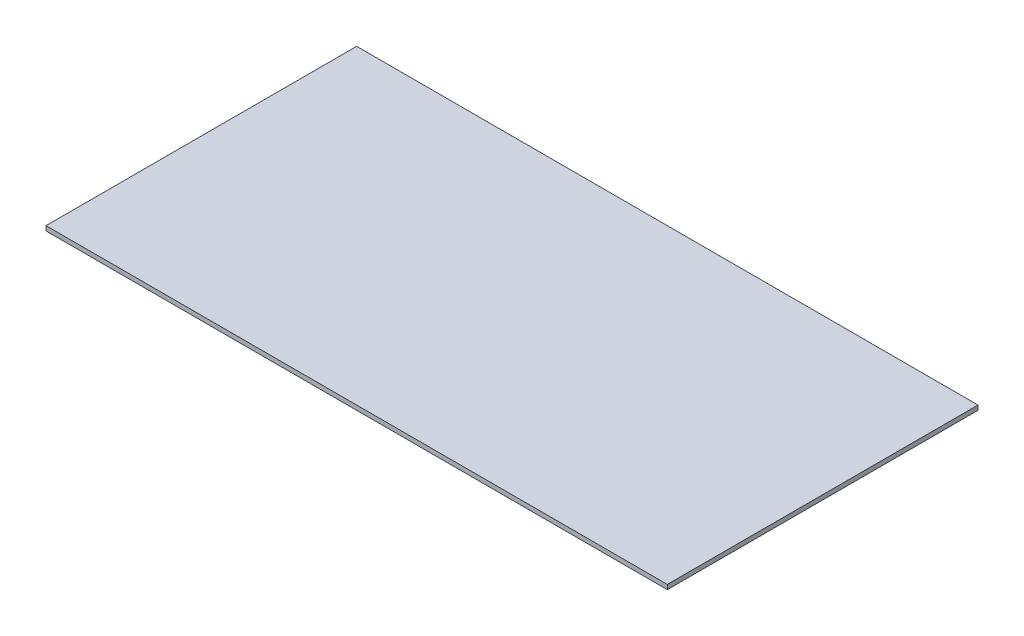
from build123d import *

# Parameters (mm, degrees)
SKETCH1_W           = 101.8
SKETCH1_H           = 50.9
BOSS_EXTRUDE1_DEPTH = 0.75


with BuildPart() as part:
    # Sketch1 → Boss-Extrude1 (new body)
    with BuildSketch(Plane(origin=(0, 0, 0), x_dir=(1, 0, 0), z_dir=(0, 1, 0))):
        Rectangle(SKETCH1_W, SKETCH1_H)
    extrude(amount=BOSS_EXTRUDE1_DEPTH)


solid = part.part
